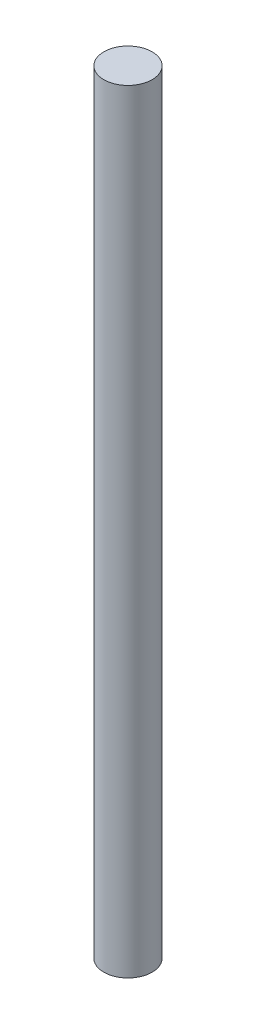
from build123d import *

# Parameters (mm, degrees)
SKETCH1_R           = 2.5
BOSS_EXTRUDE1_DEPTH = 80


with BuildPart() as part:
    # Sketch1 → Boss-Extrude1 (new body)
    with BuildSketch(Plane(origin=(0, 0, 0), x_dir=(1, 0, 0), z_dir=(0, 1, 0))):
        with Locations(Location((0, 0, 0), (0, 0, 270))):
            Circle(SKETCH1_R)
    extrude(amount=BOSS_EXTRUDE1_DEPTH)


solid = part.part
